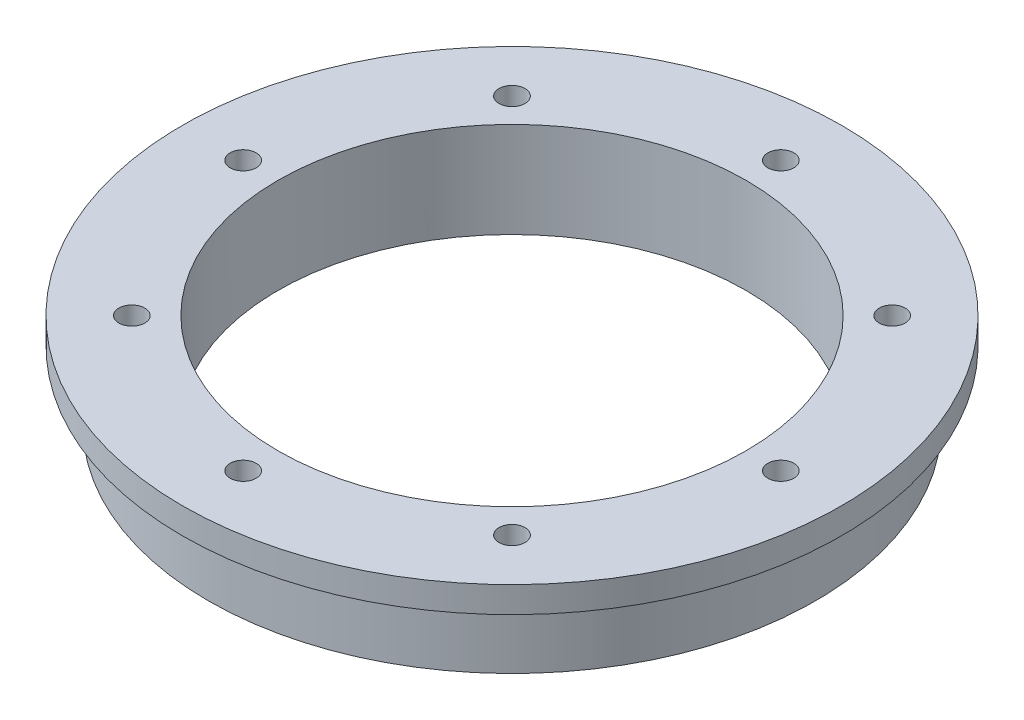
from build123d import *
from build123d.topology import SkipClean

# Parameters (mm, degrees)
SKETCH_1_R          = 38
SKETCH_1_R_2        = 27
EXTRUDE_1_DEPTH     = 3
EXTRUDE_START       = 8
SKETCH_2_R          = 35
SKETCH_2_R_2        = 27
EXTRUDE_2_DEPTH     = 8
SKETCH_4_R          = 1.5
CUT_EXTRUDE_1_DEPTH = 55.854352608


with BuildPart() as part:
    # 草图1 → 凸台-拉伸1 (new body)
    with BuildSketch(Plane(origin=(0, 0, 0), x_dir=(1, 0, 0), z_dir=(0, 1, 0))):
        with Locations(Location((0, 0, 0), (0, 0, 270))):
            Circle(SKETCH_1_R)
        with Locations(Location((0, 0, 0), (0, 0, 270))):
            Circle(SKETCH_1_R_2, mode=Mode.SUBTRACT)
    extrude(amount=EXTRUDE_1_DEPTH)

    # 草图2 → 凸台-拉伸2 (add)
    with SkipClean():  # the faces are left unmerged after this step: merging them gives an invalid solid
        with BuildSketch(Plane.XZ.offset(EXTRUDE_START)):
            with Locations(Location((0, 0, 0), (0, 0, 270))):
                Circle(SKETCH_2_R)
            with Locations(Location((0, 0, 0), (0, 0, 270))):
                Circle(SKETCH_2_R_2, mode=Mode.SUBTRACT)
        extrude(amount=-EXTRUDE_2_DEPTH)

    # 草图4 → 切除-拉伸1 (cut, through all)
    with SkipClean():  # the faces are left unmerged after this step: merging them gives an invalid solid
        with BuildSketch(Plane.XZ.offset(8)):
            with Locations(Location((0, 31, 0), (0, 0, 270))):
                Circle(SKETCH_4_R)
            with Locations(Location((21.920310217, 21.920310217, 0), (0, 0, 270))):
                Circle(SKETCH_4_R)
            with Locations(Location((31, 0, 0), (0, 0, 270))):
                Circle(SKETCH_4_R)
            with Locations(Location((21.920310217, -21.920310217, 0), (0, 0, 270))):
                Circle(SKETCH_4_R)
            with Locations(Location((0, -31, 0), (0, 0, 270))):
                Circle(SKETCH_4_R)
            with Locations(Location((-21.920310217, -21.920310217, 0), (0, 0, 270))):
                Circle(SKETCH_4_R)
            with Locations(Location((-31, 0, 0), (0, 0, 270))):
                Circle(SKETCH_4_R)
            with Locations(Location((-21.920310217, 21.920310217, 0), (0, 0, 270))):
                Circle(SKETCH_4_R)
        extrude(amount=-CUT_EXTRUDE_1_DEPTH, mode=Mode.SUBTRACT)


solid = part.part
